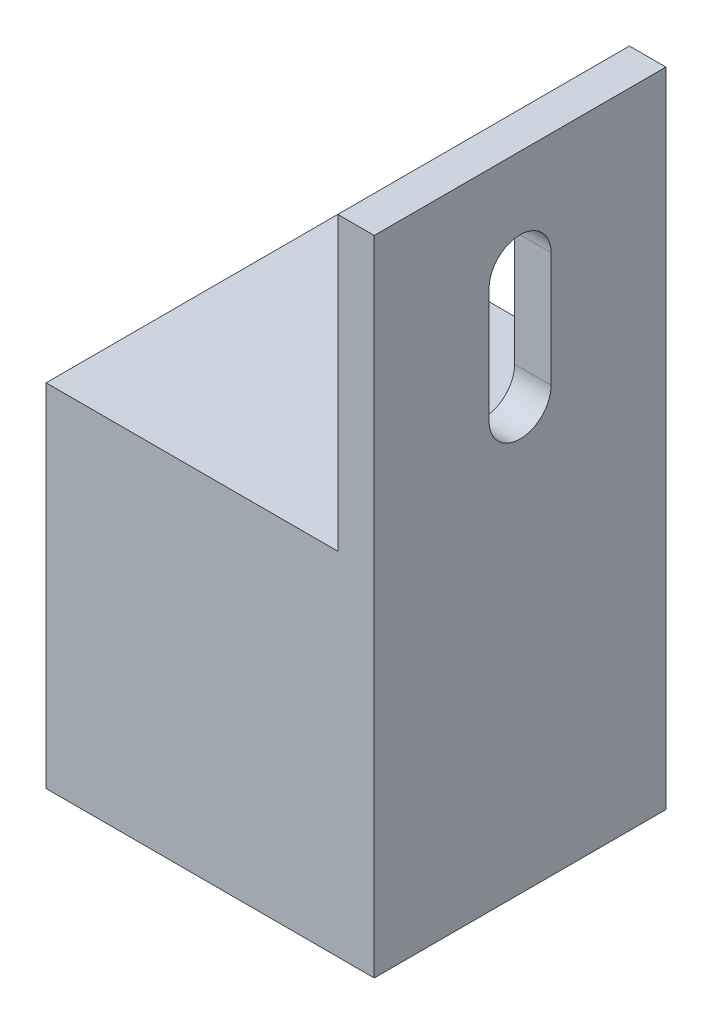
from build123d import *

# Parameters (mm, degrees)
SKETCH1_W           = 25.4
SKETCH1_H           = 25.4
BOSS_EXTRUDE1_DEPTH = 30.6
SKETCH2_W           = 25.4
SKETCH2_H           = 56
BOSS_EXTRUDE2_DEPTH = 3.175


with BuildPart() as part:
    # Sketch1 → Boss-Extrude1 (new body)
    with BuildSketch(Plane(origin=(0, 0, 0), x_dir=(1, 0, 0), z_dir=(0, 1, 0))):
        Rectangle(SKETCH1_W, SKETCH1_H)
    extrude(amount=BOSS_EXTRUDE1_DEPTH)

    # Sketch2 → Boss-Extrude2 (add)
    with BuildSketch(Plane(origin=(12.7, 0, 0), x_dir=(0, 0, -1), z_dir=(1, 0, 0))):
        with Locations((0, 28)):
            Rectangle(SKETCH2_W, SKETCH2_H)
        with BuildLine():
            Line((2.7, 47), (2.7, 37))
            ThreePointArc((2.7, 37), (0, 34.3), (-2.7, 37))
            Line((-2.7, 37), (-2.7, 47))
            ThreePointArc((-2.7, 47), (0, 49.7), (2.7, 47))
        make_face(mode=Mode.SUBTRACT)
    extrude(amount=BOSS_EXTRUDE2_DEPTH)


solid = part.part
